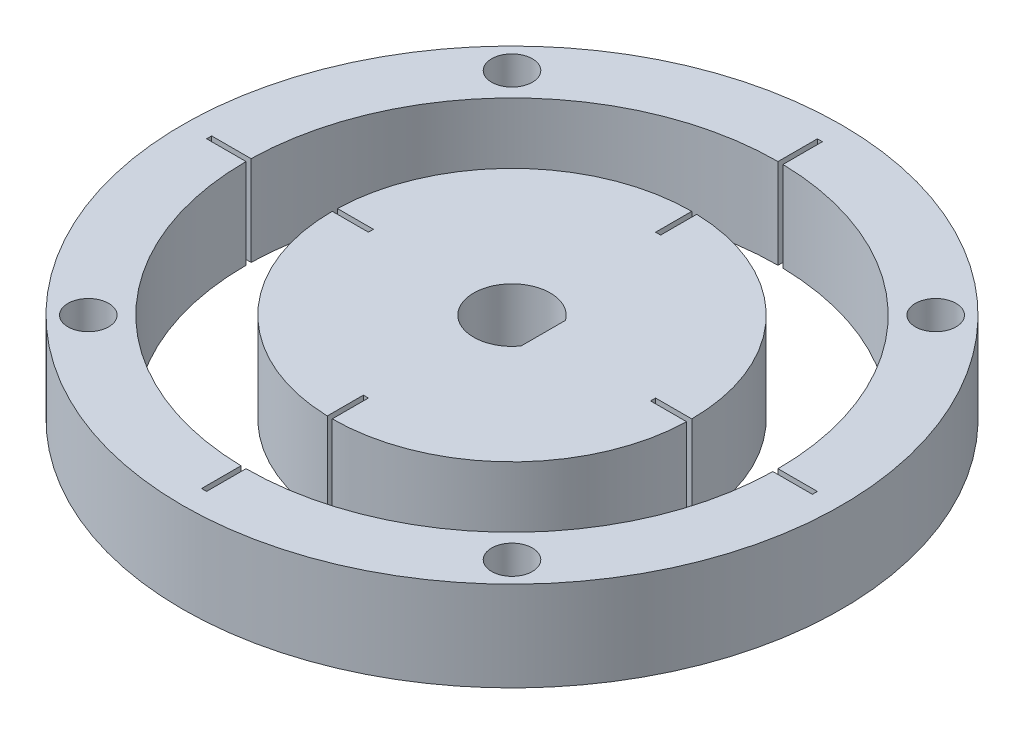
from build123d import *

# Parameters (mm, degrees)
SKETCH2_R             = 27.5
SKETCH2_R_2           = 22.197520882
BOSS_EXTRUDE3_DEPTH   = 7.5
BOSS_EXTRUDE3_2_DEPTH = 7.5
SKETCH5_R             = 1.7
SKETCH5_W             = 0.42
SKETCH5_H             = 13.5
SKETCH5_W_2           = 13.5
SKETCH5_H_2           = 0.42
CUT_EXTRUDE6_DEPTH    = 40.607448794
CUT_EXTRUDE8_DEPTH    = 7.5


with BuildPart() as part:
    # Sketch2 → Boss-Extrude3 (new body)
    with BuildSketch(Plane(origin=(0, 0, 0), x_dir=(1, 0, 0), z_dir=(0, 1, 0))):
        with Locations(Location((0, 0, 0), (0, 0, 270))):
            Circle(SKETCH2_R)
        with Locations(Location((0, 0, 0), (0, 0, 270))):
            Circle(SKETCH2_R_2, mode=Mode.SUBTRACT)
    extrude(amount=BOSS_EXTRUDE3_DEPTH)

    # Sketch5 → Cut-Extrude6 (cut, through all)
    with BuildSketch(Plane.XZ):
        with Locations(Location((-17.67766953, 17.67766953, 0), (0, 0, 270))):
            Circle(SKETCH5_R)
        with Locations(Location((17.67766953, 17.67766953, 0), (0, 0, 270))):
            Circle(SKETCH5_R)
        with Locations(Location((17.67766953, -17.67766953, 0), (0, 0, 270))):
            Circle(SKETCH5_R)
        with Locations(Location((-17.67766953, -17.67766953, 0), (0, 0, 270))):
            Circle(SKETCH5_R)
        with Locations((0.21, -18.733167206)):
            Rectangle(SKETCH5_W, SKETCH5_H)
        with Locations((-18.733167206, -0.21)):
            Rectangle(SKETCH5_W_2, SKETCH5_H_2)
        with Locations((-0.21, 18.733167206)):
            Rectangle(SKETCH5_W, SKETCH5_H)
        with Locations((18.733167206, 0.21)):
            Rectangle(SKETCH5_W_2, SKETCH5_H_2)
    extrude(amount=-CUT_EXTRUDE6_DEPTH, mode=Mode.SUBTRACT)


with BuildPart() as body_2:
    # Sketch2 → Boss-Extrude3 2 (new body)
    with BuildSketch(Plane(origin=(0, 0, 0), x_dir=(1, 0, 0), z_dir=(0, 1, 0))):
        with BuildLine():
            Line((0, -15), (0, -11.983167206))
            Line((0, -11.983167206), (-0.42, -11.983167206))
            Line((-0.42, -11.983167206), (-0.42, -14.994118847))
            ThreePointArc((-0.42, -14.994118847), (-10.754068997, -10.457055035), (-15, 0))
            Line((-15, 0), (-11.983167206, 0))
            Line((-11.983167206, 0), (-11.983167206, 0.42))
            Line((-11.983167206, 0.42), (-14.994118847, 0.42))
            ThreePointArc((-14.994118847, 0.42), (-10.457055035, 10.754068997), (0, 15))
            Line((0, 15), (0, 11.983167206))
            Line((0, 11.983167206), (0.42, 11.983167206))
            Line((0.42, 11.983167206), (0.42, 14.994118847))
            ThreePointArc((0.42, 14.994118847), (10.754068997, 10.457055035), (15, 0))
            Line((15, 0), (11.983167206, 0))
            Line((11.983167206, 0), (11.983167206, -0.42))
            Line((11.983167206, -0.42), (14.994118847, -0.42))
            ThreePointArc((14.994118847, -0.42), (10.457055035, -10.754068997), (0, -15))
        make_face()
    extrude(amount=BOSS_EXTRUDE3_2_DEPTH)

    # Sketch7 → Cut-Extrude8 (cut)
    with BuildSketch(Plane.XZ):
        with BuildLine():
            Line((2.611025673, 1.850012144), (2.611025673, -1.850012144))
            ThreePointArc((2.611025673, -1.850012144), (-3.2, 0), (2.611025673, 1.850012144))
        make_face()
    extrude(amount=-CUT_EXTRUDE8_DEPTH, mode=Mode.SUBTRACT)


solid = Compound([part.part, body_2.part])
